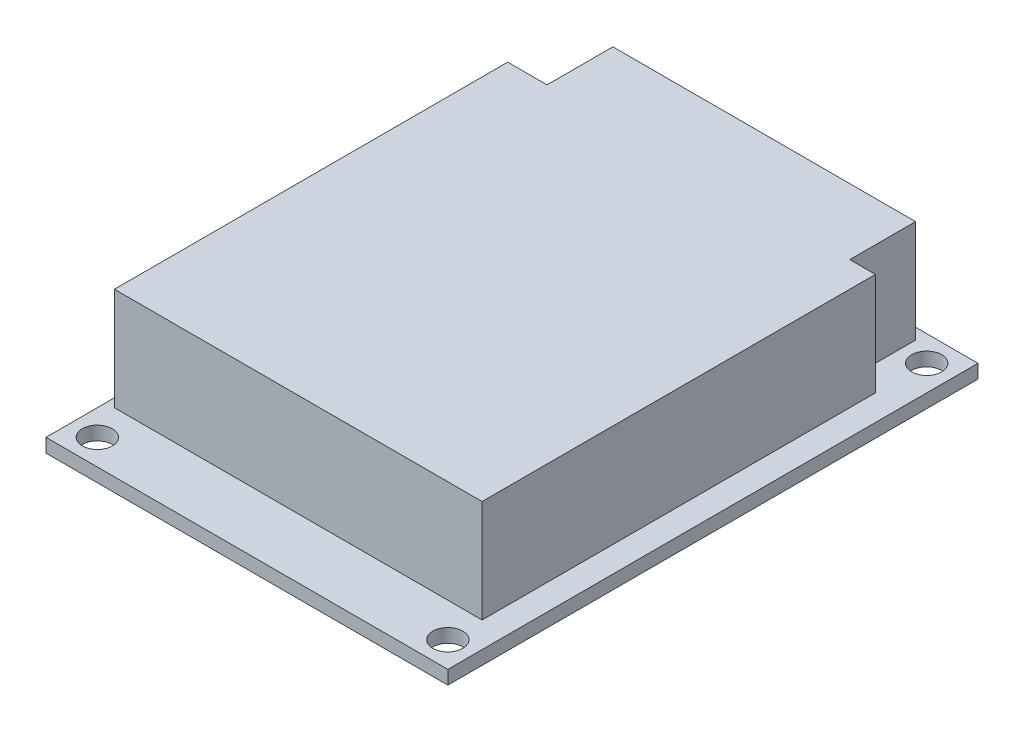
from build123d import *

# Parameters (mm, degrees)
SKETCH1_W           = 47
SKETCH1_H           = 62
SKETCH1_R           = 1.75
BOSS_EXTRUDE1_DEPTH = 1.6
BOSS_EXTRUDE2_DEPTH = 12


with BuildPart() as part:
    # Sketch1 → Boss-Extrude1 (new body)
    with BuildSketch(Plane(origin=(0, 0, 0), x_dir=(1, 0, 0), z_dir=(0, 1, 0))):
        Rectangle(SKETCH1_W, SKETCH1_H)
        with Locations(Location((-20.5, -28, 0), (0, 0, 270))):
            Circle(SKETCH1_R, mode=Mode.SUBTRACT)
        with Locations(Location((20.5, -28, 0), (0, 0, 270))):
            Circle(SKETCH1_R, mode=Mode.SUBTRACT)
        with Locations(Location((20.5, 28, 0), (0, 0, 270))):
            Circle(SKETCH1_R, mode=Mode.SUBTRACT)
        with Locations(Location((-20.5, 28, 0), (0, 0, 270))):
            Circle(SKETCH1_R, mode=Mode.SUBTRACT)
    extrude(amount=-BOSS_EXTRUDE1_DEPTH)

    # Sketch3 → Boss-Extrude2 (add)
    with BuildSketch(Plane(origin=(0, 0, 0), x_dir=(1, 0, 0), z_dir=(0, 1, 0))):
        Polygon((-22.5, 22), (-17.9, 22), (-17.9, 29.7), (17.5, 29.7), (17.5, 22), (20.5, 22), (20.5, -24), (-22.5, -24), align=None)
    extrude(amount=BOSS_EXTRUDE2_DEPTH)


solid = part.part
